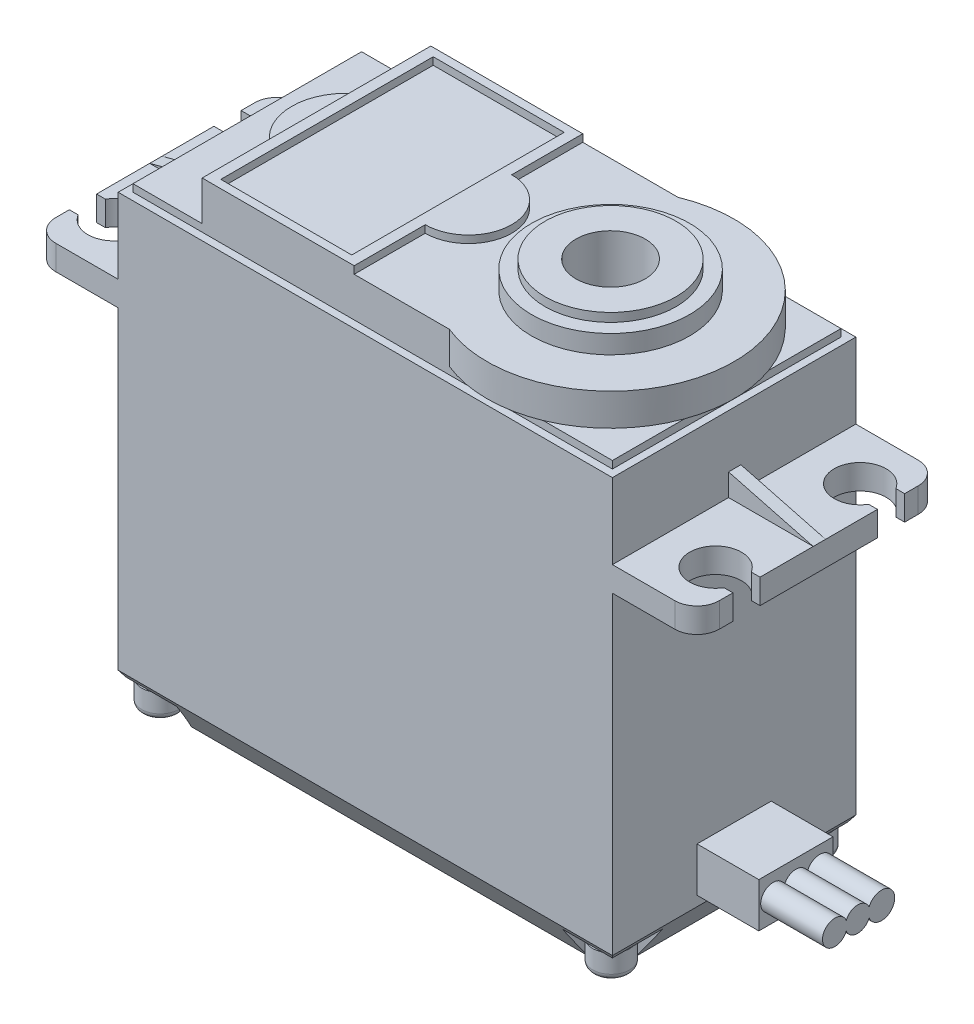
from build123d import *

# Parameters (mm, degrees)
SKETCH1_W            = 40
SKETCH1_H            = 36.5
BOSS_EXTRUDE1_DEPTH  = 19.7
CHAMFER1_SIZE        = 2
CHAMFER1_SIZE2       = 3
CUT_EXTRUDE1_DEPTH   = 2.5
SKETCH4_R            = 1.5
BOSS_EXTRUDE2_DEPTH  = 2
FILLET1_R            = 0.5
FILLET3_R            = 0.5
FILLET4_R            = 0.5
FILLET5_R            = 0.5
SKETCH5_W            = 53.7
SKETCH5_H            = 19.7
BOSS_EXTRUDE3_DEPTH  = 2
CUT_EXTRUDE2_DEPTH   = 2
FILLET9_R            = 1.8
BOSS_EXTRUDE4_DEPTH  = 1
SKETCH8_W            = 38.8
SKETCH8_H            = 18.5
BOSS_EXTRUDE5_DEPTH  = 0.6
BOSS_EXTRUDE6_DEPTH  = 2.6
SKETCH10_W           = 10.6
SKETCH10_H           = 17.190691902
BOSS_EXTRUDE7_DEPTH  = 0.6
SKETCH11_R           = 6.4
BOSS_EXTRUDE8_DEPTH  = 1.5
SKETCH12_R           = 5.3
BOSS_EXTRUDE9_DEPTH  = 0.7
CUT_EXTRUDE3_DEPTH   = 1.2
LPATTERN1_COUNT      = 2
LPATTERN1_PITCH      = 36.5
LPATTERN1_COUNT_DIR2 = 2
LPATTERN1_PITCH_DIR2 = 16.3
SKETCH16_W           = 6
SKETCH16_H           = 3.6
BOSS_EXTRUDE11_DEPTH = 5
BOSS_EXTRUDE16_DEPTH = 5
BOSS_EXTRUDE42_DEPTH = 5
SKETCH13_R           = 2.8
CUT_EXTRUDE4_DEPTH   = 11.5


with BuildPart() as part:
    # Sketch1 → Boss-Extrude1 (new body)
    with BuildSketch(Plane.XY):
        Rectangle(SKETCH1_W, SKETCH1_H)
    extrude(amount=BOSS_EXTRUDE1_DEPTH)

    # Chamfer1
    chamfer1_edges = [part.edges().sort_by_distance(p)[0] for p in [
        (0, -18.25, 19.7),
        (0, -18.25, 0),
        (20, -18.25, 9.85),
        (-20, -18.25, 9.85),
    ]]
    chamfer1_side = [part.faces().sort_by_distance(p)[0] for p in [
        (0, -18.25, 9.85),
    ]]
    chamfer(chamfer1_edges, length=CHAMFER1_SIZE, length2=CHAMFER1_SIZE2, reference=chamfer1_side[0])

    # Sketch2 → Cut-Extrude1 (cut)
    with BuildSketch(Plane.XZ.offset(18.25)):
        with BuildLine():
            Line((20, 15.3), (20, 19.7))
            Line((20, 19.7), (15.6, 19.7))
            ThreePointArc((15.6, 19.7), (16.888730163, 16.588730163), (20, 15.3))
        make_face()
        with BuildLine():
            Line((20, 4.4), (20, 0))
            Line((20, 0), (15.6, 0))
            ThreePointArc((15.6, 0), (16.888730163, 3.111269837), (20, 4.4))
        make_face()
        with BuildLine():
            Line((-15.6, 0), (-20, 0))
            Line((-20, 0), (-20, 4.4))
            ThreePointArc((-20, 4.4), (-16.888730163, 3.111269837), (-15.6, 0))
        make_face()
        with BuildLine():
            Line((-20, 15.3), (-20, 19.7))
            Line((-20, 19.7), (-15.6, 19.7))
            ThreePointArc((-15.6, 19.7), (-16.888730163, 16.588730163), (-20, 15.3))
        make_face()
    extrude(amount=-CUT_EXTRUDE1_DEPTH, mode=Mode.SUBTRACT)

    # Sketch4 → Boss-Extrude2 (add)
    with BuildSketch(Plane.XZ.offset(15.75)):
        with Locations(Location((18.20504142, 18.001219169, 0), (0, 0, 114.453388665))):
            Circle(SKETCH4_R)
        with Locations(Location((18.20504142, 1.751219169, 0), (0, 0, 250.954058998))):
            Circle(SKETCH4_R)
        with Locations(Location((-18.29495858, 1.751219169, 0), (0, 0, 203.869136849))):
            Circle(SKETCH4_R)
        with Locations(Location((-18.29495858, 18.001219169, 0), (0, 0, 156.130863151))):
            Circle(SKETCH4_R)
    extrude(amount=BOSS_EXTRUDE2_DEPTH)

    # Fillet1
    fillet1_edges = [part.edges().sort_by_distance(p)[0] for p in [
        (-16.923250494, -17.75, 17.39424559),
    ]]
    fillet(fillet1_edges, radius=FILLET1_R)

    # Fillet3
    fillet3_edges = [part.edges().sort_by_distance(p)[0] for p in [
        (-16.923250494, -17.75, 2.358192748),
    ]]
    fillet(fillet3_edges, radius=FILLET3_R)

    # Fillet4
    fillet4_edges = [part.edges().sort_by_distance(p)[0] for p in [
        (18.6945307, -17.75, 3.169105006),
    ]]
    fillet(fillet4_edges, radius=FILLET4_R)

    # Fillet5
    fillet5_edges = [part.edges().sort_by_distance(p)[0] for p in [
        (18.825970669, -17.75, 16.635771672),
    ]]
    fillet(fillet5_edges, radius=FILLET5_R)

    # Sketch5 → Boss-Extrude3 (add)
    with BuildSketch(Plane(origin=(0, 10.15, 0), x_dir=(-1, 0, 0), z_dir=(0, -1, 0))):
        with Locations((0, -9.85)):
            Rectangle(SKETCH5_W, SKETCH5_H)
    extrude(amount=-BOSS_EXTRUDE3_DEPTH)

    # Sketch6 → Cut-Extrude2 (cut)
    with BuildSketch(Plane.XZ.offset(-10.15)):
        with BuildLine():
            Line((26.85, 14.6), (26.138854382, 14.6))
            ThreePointArc((26.138854382, 14.6), (22.25, 15.7), (26.138854382, 16.8))
            Line((26.138854382, 16.8), (26.85, 16.8))
            Line((26.85, 16.8), (26.85, 14.6))
        make_face()
        with BuildLine():
            Line((26.85, 2.9), (26.138854382, 2.9))
            ThreePointArc((26.138854382, 2.9), (22.25, 4), (26.138854382, 5.1))
            Line((26.138854382, 5.1), (26.85, 5.1))
            Line((26.85, 5.1), (26.85, 2.9))
        make_face()
        with BuildLine():
            Line((-26.85, 5.1), (-26.138854382, 5.1))
            ThreePointArc((-26.138854382, 5.1), (-22.25, 4), (-26.138854382, 2.9))
            Line((-26.138854382, 2.9), (-26.85, 2.9))
            Line((-26.85, 2.9), (-26.85, 5.1))
        make_face()
        with BuildLine():
            Line((-26.85, 16.8), (-26.138854382, 16.8))
            ThreePointArc((-26.138854382, 16.8), (-22.25, 15.7), (-26.138854382, 14.6))
            Line((-26.138854382, 14.6), (-26.85, 14.6))
            Line((-26.85, 14.6), (-26.85, 16.8))
        make_face()
    extrude(amount=-CUT_EXTRUDE2_DEPTH, mode=Mode.SUBTRACT)

    # Fillet9
    fillet9_edges = [part.edges().sort_by_distance(p)[0] for p in [
        (26.85, 11.15, 0),
        (-26.85, 11.15, 0),
        (-26.85, 11.15, 19.7),
        (26.85, 11.15, 19.7),
    ]]
    fillet(fillet9_edges, radius=FILLET9_R)

    # Sketch7 → Boss-Extrude4 (add)
    with BuildSketch(Plane.XY.offset(10.3)):
        Polygon((-26.85, 12.15), (-20, 13.95), (-20, 12.15), align=None)
        Polygon((20, 12.15), (20, 13.95), (26.85, 12.15), align=None)
    extrude(amount=-BOSS_EXTRUDE4_DEPTH)

    # Sketch8 → Boss-Extrude5 (add)
    with BuildSketch(Plane(origin=(0, 18.25, 0), x_dir=(1, 0, 0), z_dir=(0, 1, 0))):
        with Locations((0, -9.85)):
            Rectangle(SKETCH8_W, SKETCH8_H)
    extrude(amount=BOSS_EXTRUDE5_DEPTH)

    # Sketch9 → Boss-Extrude6 (add)
    with BuildSketch(Plane(origin=(0, 18.85, 0), x_dir=(1, 0, 0), z_dir=(0, 1, 0))):
        with BuildLine():
            Line((-13.799671038, -6.162182217), (-13.799671038, -0.6))
            Line((-13.799671038, -0.6), (6.200328962, -0.6))
            ThreePointArc((6.200328962, -0.6), (20, -9.85), (6.200328962, -19.1))
            Line((6.200328962, -19.1), (-13.799671038, -19.1))
            Line((-13.799671038, -19.1), (-13.799671038, -13.537817783))
            ThreePointArc((-13.799671038, -13.537817783), (-15.799671038, -9.85), (-13.799671038, -6.162182217))
        make_face()
    extrude(amount=BOSS_EXTRUDE6_DEPTH)

    # Sketch10 → Boss-Extrude7 (add)
    with BuildSketch(Plane(origin=(0, 21.45, 0), x_dir=(1, 0, 0), z_dir=(0, 1, 0))):
        with BuildLine():
            Line((-13.799671038, -19.1), (-13.799671038, -0.6))
            Line((-13.799671038, -0.6), (-1.499671038, -0.6))
            Line((-1.499671038, -0.6), (-1.499671038, -6.35))
            ThreePointArc((-1.499671038, -6.35), (2.000328962, -9.85), (-1.499671038, -13.35))
            Line((-1.499671038, -13.35), (-1.499671038, -19.1))
            Line((-1.499671038, -19.1), (-13.799671038, -19.1))
        make_face()
        with Locations((-7.649671038, -9.85)):
            Rectangle(SKETCH10_W, SKETCH10_H, mode=Mode.SUBTRACT)
    extrude(amount=BOSS_EXTRUDE7_DEPTH)

    # Sketch11 → Boss-Extrude8 (add)
    with BuildSketch(Plane(origin=(0, 21.45, 0), x_dir=(1, 0, 0), z_dir=(0, 1, 0))):
        with Locations(Location((10, -9.85, 0), (0, 0, 270))):
            Circle(SKETCH11_R)
    extrude(amount=BOSS_EXTRUDE8_DEPTH)

    # Sketch12 → Boss-Extrude9 (add)
    with BuildSketch(Plane(origin=(0, 22.95, 0), x_dir=(1, 0, 0), z_dir=(0, 1, 0))):
        with Locations(Location((10, -9.85, 0), (0, 0, 270))):
            Circle(SKETCH12_R)
    extrude(amount=BOSS_EXTRUDE9_DEPTH)

    # Sketch15 → Cut-Extrude3 (cut)
    with BuildSketch(Plane.XZ.offset(17.75)):
        Polygon((18.05504142, 1.601219169), (18.05504142, 0.901219169), (18.35504142, 0.901219169), (18.35504142, 1.601219169), (19.05504142, 1.601219169), (19.05504142, 1.901219169), (18.35504142, 1.901219169), (18.35504142, 2.601219169), (18.05504142, 2.601219169), (18.05504142, 1.901219169), (17.35504142, 1.901219169), (17.35504142, 1.601219169), align=None)
    cut_extrude3 = extrude(amount=-CUT_EXTRUDE3_DEPTH, mode=Mode.SUBTRACT)

    # LPattern1: Cut-Extrude3 2 × 2
    with Locations(*[(-i * LPATTERN1_PITCH, 0, j * LPATTERN1_PITCH_DIR2) for i in range(LPATTERN1_COUNT) for j in range(LPATTERN1_COUNT_DIR2) if (i, j) != (0, 0)]):
        add(cut_extrude3, mode=Mode.SUBTRACT)

    # Sketch16 → Boss-Extrude11 (add)
    with BuildSketch(Plane(origin=(20, 0, 0), x_dir=(0, 0, -1), z_dir=(1, 0, 0))):
        with Locations((-9.85, -12.65)):
            Rectangle(SKETCH16_W, SKETCH16_H)
    extrude(amount=BOSS_EXTRUDE11_DEPTH)

    # Sketch17 → Boss-Extrude16 (add)
    with BuildSketch(Plane(origin=(25, 0, 0), x_dir=(0, 0, -1), z_dir=(1, 0, 0))):
        with BuildLine():
            ThreePointArc((-10.775, -13.00161488), (-9.85, -13.621647776), (-8.925, -13.00161488))
            ThreePointArc((-8.925, -13.00161488), (-6.85, -12.621647776), (-8.925, -12.241680672))
            ThreePointArc((-8.925, -12.241680672), (-9.85, -11.621647776), (-10.775, -12.241680672))
            ThreePointArc((-10.775, -12.241680672), (-12.7, -12.621647776), (-10.775, -13.00161488))
        make_face()
    extrude(amount=BOSS_EXTRUDE16_DEPTH)

    # Sketch17<9> → Boss-Extrude42 (add)
    with BuildSketch(Plane(origin=(25, 0, 0), x_dir=(0, 0, -1), z_dir=(1, 0, 0))):
        with BuildLine():
            ThreePointArc((-10.775, -13.00161488), (-9.85, -13.621647776), (-8.925, -13.00161488))
            ThreePointArc((-8.925, -13.00161488), (-6.85, -12.621647776), (-8.925, -12.241680672))
            ThreePointArc((-8.925, -12.241680672), (-9.85, -11.621647776), (-10.775, -12.241680672))
            ThreePointArc((-10.775, -12.241680672), (-12.7, -12.621647776), (-10.775, -13.00161488))
        make_face()
    extrude(amount=BOSS_EXTRUDE42_DEPTH)

    # Sketch13 → Cut-Extrude4 (cut)
    with BuildSketch(Plane(origin=(0, 23.65, 0), x_dir=(1, 0, 0), z_dir=(0, 1, 0))):
        with Locations(Location((10, -9.85, 0), (0, 0, 270))):
            Circle(SKETCH13_R)
    extrude(amount=-CUT_EXTRUDE4_DEPTH, mode=Mode.SUBTRACT)


solid = part.part
